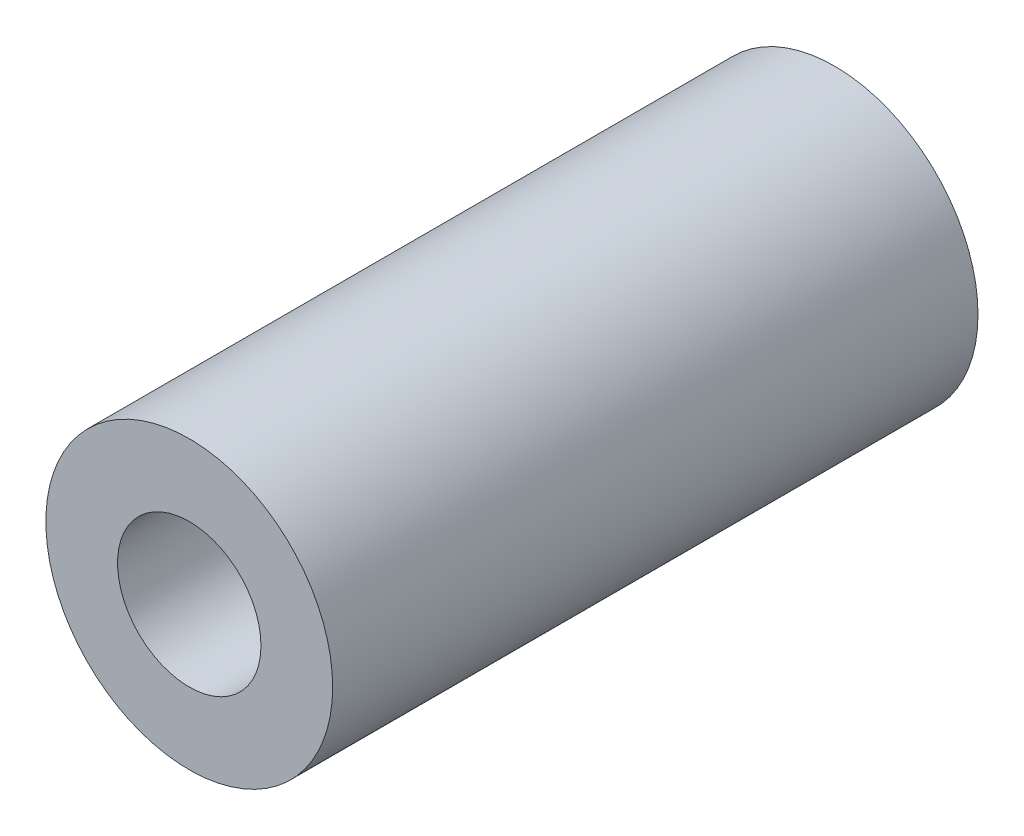
from build123d import *

# Parameters (mm, degrees)
SKETCH1_R           = 4
SKETCH1_R_2         = 2
BOSS_EXTRUDE1_DEPTH = 18


with BuildPart() as part:
    # Sketch1 → Boss-Extrude1 (new body)
    with BuildSketch(Plane.XY):
        Circle(SKETCH1_R)
        Circle(SKETCH1_R_2, mode=Mode.SUBTRACT)
    extrude(amount=BOSS_EXTRUDE1_DEPTH)


solid = part.part
